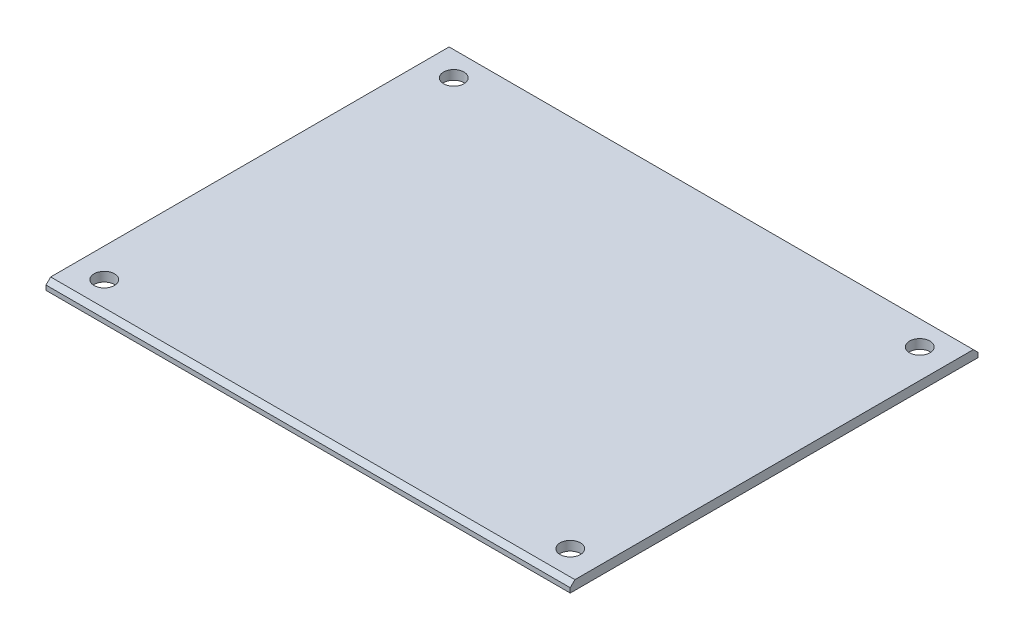
from build123d import *

# Parameters (mm, degrees)
SKETCH1_W           = 90
SKETCH1_H           = 70
BOSS_EXTRUDE1_DEPTH = 1.6
SKETCH2_R           = 1.75
CUT_EXTRUDE1_DEPTH  = 58.031219521
CHAMFER1_SIZE       = 0.8


with BuildPart() as part:
    # Sketch1 → Boss-Extrude1 (new body)
    with BuildSketch(Plane(origin=(0, 0, 0), x_dir=(1, 0, 0), z_dir=(0, 1, 0))):
        Rectangle(SKETCH1_W, SKETCH1_H)
    extrude(amount=BOSS_EXTRUDE1_DEPTH)

    # Sketch2 → Cut-Extrude1 (cut, through all)
    with BuildSketch(Plane(origin=(0, 1.6, 0), x_dir=(1, 0, 0), z_dir=(0, 1, 0))):
        with Locations(Location((-40, -30, 0), (0, 0, 270))):
            Circle(SKETCH2_R)
        with Locations(Location((-40, 30, 0), (0, 0, 270))):
            Circle(SKETCH2_R)
        with Locations(Location((40, 30, 0), (0, 0, 270))):
            Circle(SKETCH2_R)
        with Locations(Location((40, -30, 0), (0, 0, 270))):
            Circle(SKETCH2_R)
    extrude(amount=-CUT_EXTRUDE1_DEPTH, mode=Mode.SUBTRACT)

    # Chamfer1
    chamfer1_edges = [part.edges().sort_by_distance(p)[0] for p in [
        (0, 1.6, 35),
        (0, 1.6, -35),
    ]]
    chamfer(chamfer1_edges, length=CHAMFER1_SIZE)


solid = part.part
